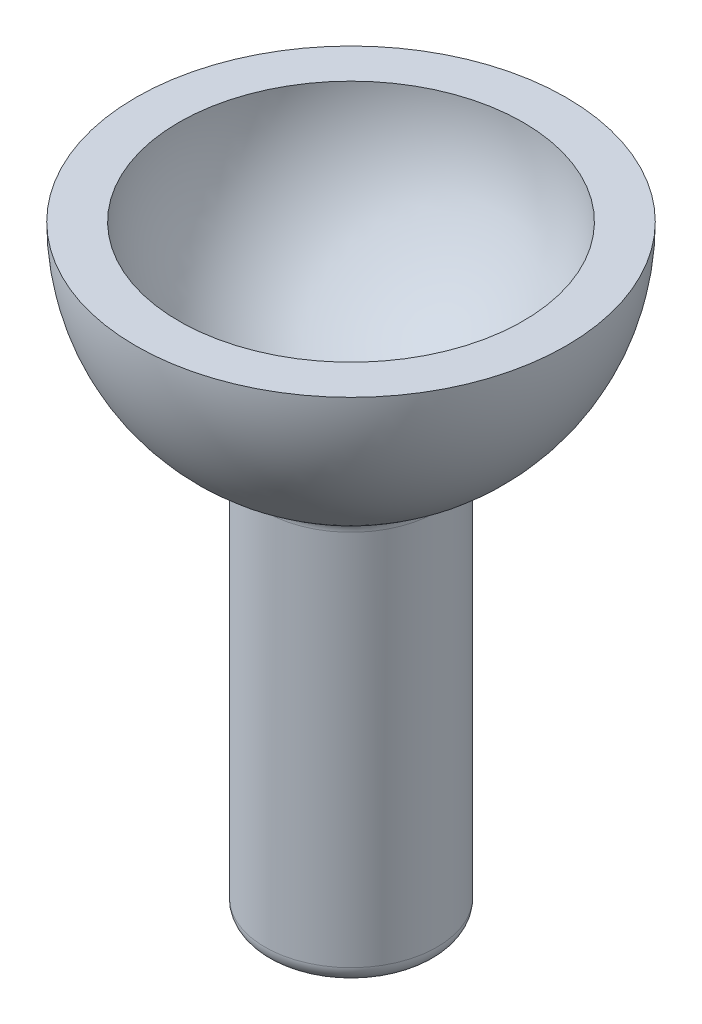
from build123d import *

# Parameters (mm, degrees)
FILLET1_R = 1


with BuildPart() as part:
    # Sketch1 → Revolve2 (revolve)
    with BuildSketch(Plane.XY, mode=Mode.PRIVATE) as revolve2_sk:
        with BuildLine():
            Line((12.5, 0), (10, 0))
            ThreePointArc((10, 0), (7.071067812, -7.071067812), (0, -10))
            Line((0, -10), (0, -35))
            Line((0, -35), (5, -35))
            Line((5, -35), (5, -11.456439237))
            ThreePointArc((5, -11.456439237), (10.458250332, -6.846531969), (12.5, 0))
        make_face()
    revolve(revolve2_sk.sketch.rotate(Axis((0, -11.87690577, 0), (0, 1, 0)), 90), axis=Axis((0, -11.87690577, 0), (0, 1, 0)))

    # Fillet1
    fillet1_edges = [part.edges().sort_by_distance(p)[0] for p in [
        (0, -11.456439237, 5),
        (0, -35, 5),
    ]]
    fillet(fillet1_edges, radius=FILLET1_R)


solid = part.part
